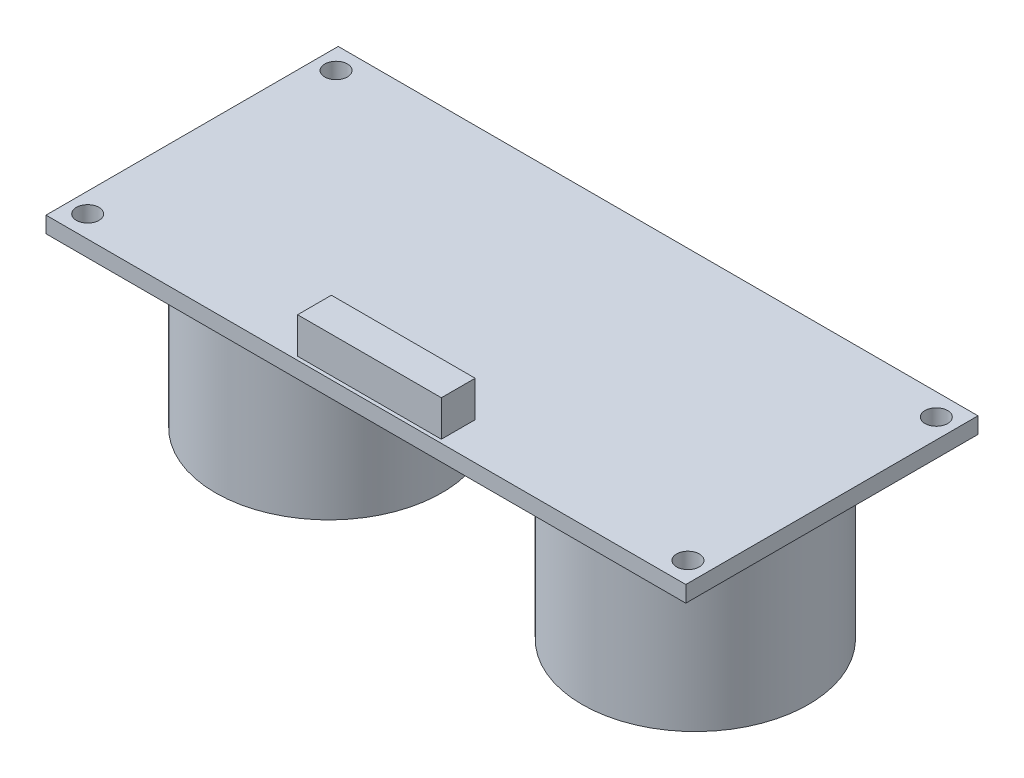
from build123d import *

# Parameters (mm, degrees)
SKETCH1_W           = 22.606
SKETCH1_H           = 10.3251
SKETCH1_R           = 0.8
BOSS_EXTRUDE1_DEPTH = 0.5715
SKETCH3_W           = 5.08
SKETCH3_H           = 2.3876
BOSS_EXTRUDE2_DEPTH = 2.54
SKETCH4_R           = 8.001
BOSS_EXTRUDE3_DEPTH = 12.192


with BuildPart() as part:
    # Sketch1 → Boss-Extrude1 (new, symmetric)
    with BuildSketch(Plane(origin=(0, 0, 0), x_dir=(1, 0, 0), z_dir=(0, 1, 0))):
        with Locations((-11.303, 5.16255)):
            Rectangle(SKETCH1_W, SKETCH1_H)
        with Locations(Location((-21.209, 8.7757, 0), (0, 0, 270))):
            Circle(SKETCH1_R, mode=Mode.SUBTRACT)
    boss_extrude1 = extrude(amount=BOSS_EXTRUDE1_DEPTH, both=True)

    # Mirror1: Boss-Extrude1 across Front Plane
    add(boss_extrude1.mirror(Plane.XY))

    # Sketch3 → Boss-Extrude2 (add)
    with BuildSketch(Plane(origin=(0, 0.5715, 0), x_dir=(1, 0, 0), z_dir=(0, 1, 0))):
        with Locations((-2.54, -8.8773)):
            Rectangle(SKETCH3_W, SKETCH3_H)
    extrude(amount=BOSS_EXTRUDE2_DEPTH)

    # Sketch4 → Boss-Extrude3 (add)
    with BuildSketch(Plane.XZ.offset(0.5715)):
        with Locations(Location((-12.954, 0, 0), (0, 0, 90))):
            Circle(SKETCH4_R)
    extrude(amount=BOSS_EXTRUDE3_DEPTH)

    # Mirror3: part across plane


with BuildPart() as part_1:
    add(part.part)
    add(part.part.mirror(Plane(origin=(0, 0, 0), x_dir=(0, 0, 1), z_dir=(1, 0, 0))))


solid = part_1.part
